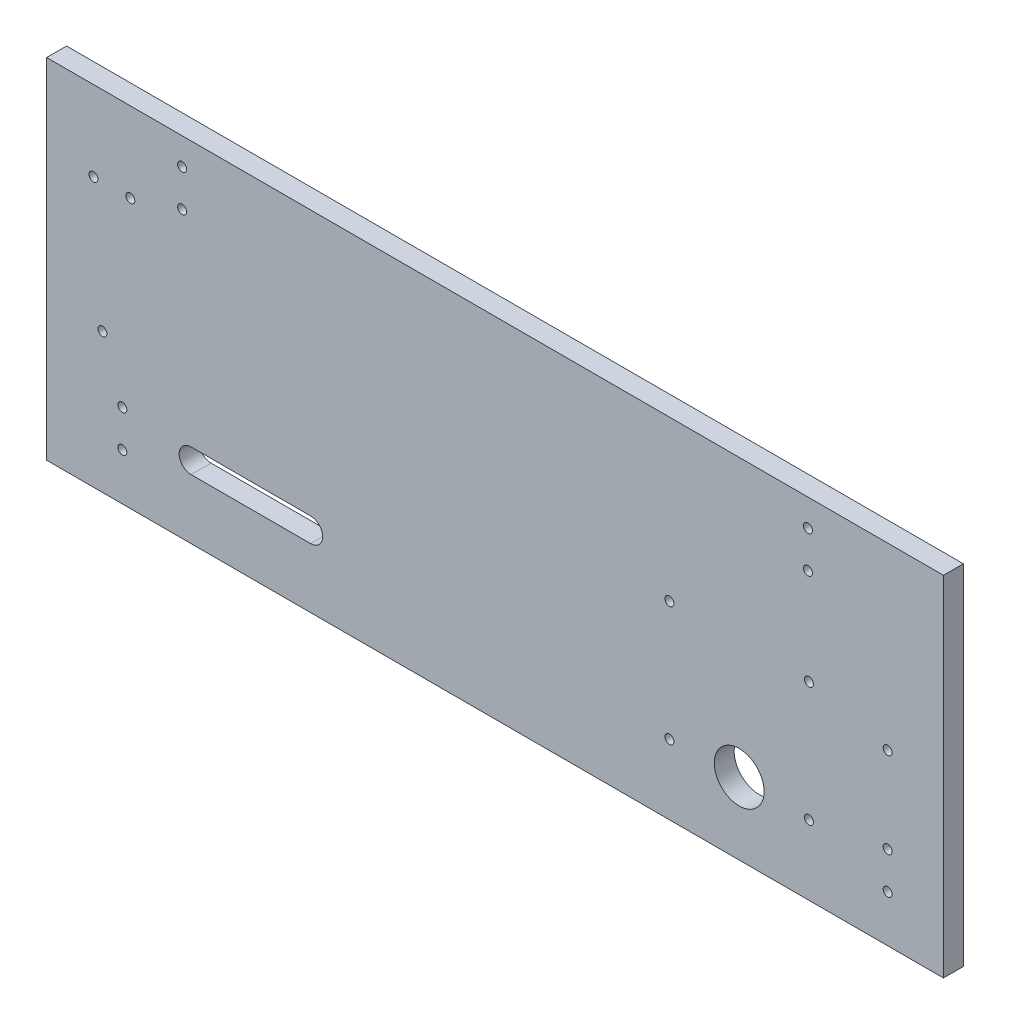
from build123d import *

# Parameters (mm, degrees)
SCHIZZO1_W                   = 450
SCHIZZO1_H                   = 175
ESTRUSIONE_ESTRUSIONE1_DEPTH = 10
SCHIZZO2_R                   = 12.5
SCHIZZO2_R_2                 = 2.25
TAGLIO_ESTRUSIONE1_DEPTH     = 10


with BuildPart() as part:
    # Schizzo1 → Estrusione-Estrusione1 (new body)
    with BuildSketch(Plane.XY):
        with Locations((225, 87.5)):
            Rectangle(SCHIZZO1_W, SCHIZZO1_H)
    extrude(amount=ESTRUSIONE_ESTRUSIONE1_DEPTH)

    # Schizzo2 → Taglio-Estrusione1 (cut)
    with BuildSketch(Plane.XY.offset(10)):
        with Locations((347.5, 36)):
            Circle(SCHIZZO2_R)
        with Locations((382, 161.5)):
            Circle(SCHIZZO2_R_2)
        with Locations((382, 143)):
            Circle(SCHIZZO2_R_2)
        with Locations((68, 161.5)):
            Circle(SCHIZZO2_R_2)
        with Locations((68, 143)):
            Circle(SCHIZZO2_R_2)
        with Locations((38, 42)):
            Circle(SCHIZZO2_R_2)
        with Locations((38, 23.5)):
            Circle(SCHIZZO2_R_2)
        with Locations((422, 23.5)):
            Circle(SCHIZZO2_R_2)
        with Locations((422, 42)):
            Circle(SCHIZZO2_R_2)
        with Locations((23.5, 134.933694222)):
            Circle(SCHIZZO2_R_2)
        with Locations((42, 134.933694222)):
            Circle(SCHIZZO2_R_2)
        with Locations((28, 70)):
            Circle(SCHIZZO2_R_2)
        with Locations((422, 85)):
            Circle(SCHIZZO2_R_2)
        with Locations((312.5, 95)):
            Circle(SCHIZZO2_R_2)
        with Locations((382.5, 95)):
            Circle(SCHIZZO2_R_2)
        with Locations((382.5, 35)):
            Circle(SCHIZZO2_R_2)
        with Locations((312.5, 35)):
            Circle(SCHIZZO2_R_2)
        with BuildLine():
            Line((72.5, 42), (132.5, 42))
            ThreePointArc((132.5, 42), (138.5, 36), (132.5, 30))
            Line((132.5, 30), (72.5, 30))
            ThreePointArc((72.5, 30), (66.5, 36), (72.5, 42))
        make_face()
    extrude(amount=-TAGLIO_ESTRUSIONE1_DEPTH, mode=Mode.SUBTRACT)


solid = part.part
